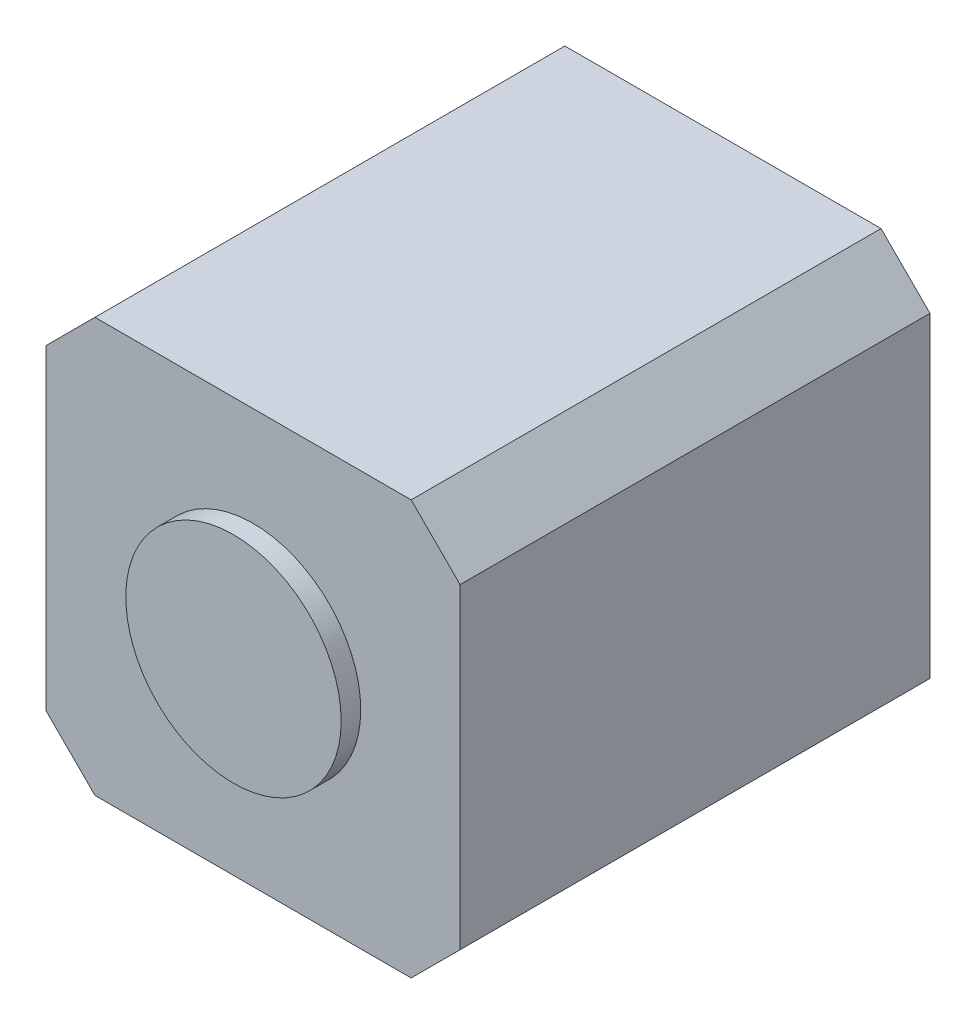
from build123d import *

# Parameters (mm, degrees)
SKETCH1_W           = 42.3
SKETCH1_H           = 42.3
BOSS_EXTRUDE1_DEPTH = 48
SKETCH2_R           = 11
BOSS_EXTRUDE2_DEPTH = 2
CHAMFER1_SIZE       = 5


with BuildPart() as part:
    # Sketch1 → Boss-Extrude1 (new body)
    with BuildSketch(Plane.XY):
        with Locations((21.15, -21.15)):
            Rectangle(SKETCH1_W, SKETCH1_H)
    extrude(amount=BOSS_EXTRUDE1_DEPTH)

    # Sketch2 → Boss-Extrude2 (add)
    with BuildSketch(Plane.XY.offset(48)):
        with Locations((21.15, -21.15)):
            Circle(SKETCH2_R)
    extrude(amount=BOSS_EXTRUDE2_DEPTH)

    # Chamfer1
    chamfer1_edges = [part.edges().sort_by_distance(p)[0] for p in [
        (0, 0, 24),
        (42.3, 0, 24),
        (42.3, -42.3, 24),
        (0, -42.3, 24),
    ]]
    chamfer(chamfer1_edges, length=CHAMFER1_SIZE)


solid = part.part
